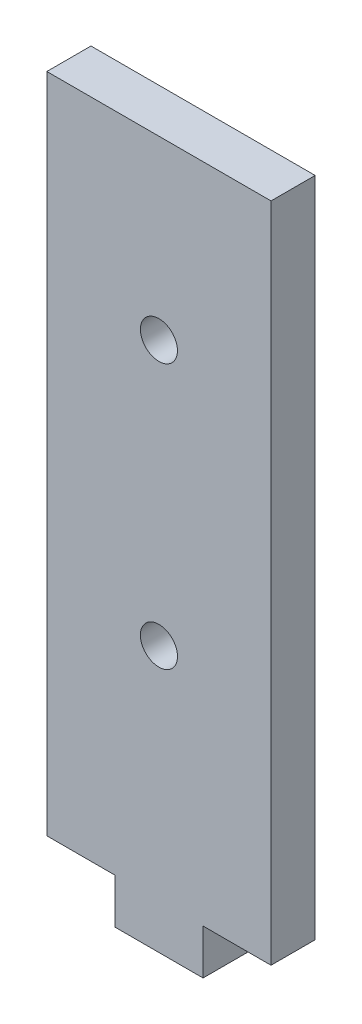
from build123d import *

# Parameters (mm, degrees)
SKETCH1_W           = 25.4
SKETCH1_H           = 75
SKETCH1_R           = 2.1
BOSS_EXTRUDE1_DEPTH = 5
SKETCH2_W           = 10
SKETCH2_H           = 10.2
BOSS_EXTRUDE2_DEPTH = 5


with BuildPart() as part:
    # Sketch1 → Boss-Extrude1 (new body)
    with BuildSketch(Plane.XY):
        Rectangle(SKETCH1_W, SKETCH1_H)
        with Locations((0, -12.5)):
            Circle(SKETCH1_R, mode=Mode.SUBTRACT)
        with Locations((0, 17.5)):
            Circle(SKETCH1_R, mode=Mode.SUBTRACT)
    extrude(amount=BOSS_EXTRUDE1_DEPTH)

    # Sketch2 → Boss-Extrude2 (add)
    with BuildSketch(Plane.XY.offset(5)):
        with Locations((0, -37.5)):
            Rectangle(SKETCH2_W, SKETCH2_H)
    extrude(amount=-BOSS_EXTRUDE2_DEPTH)


solid = part.part
